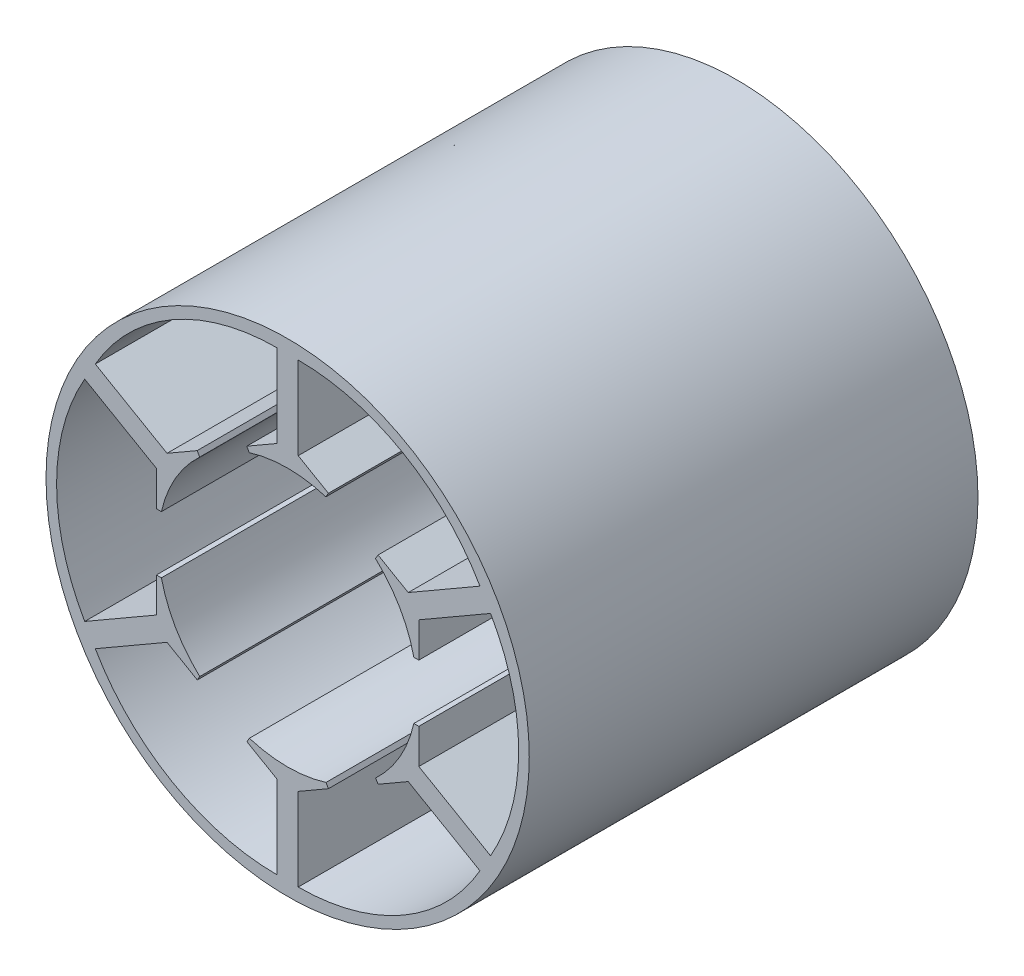
from build123d import *

# Parameters (mm, degrees)
MOTOR_BASE_R                    = 35
STATOR_SHELL_DEPTH              = 65
MOTOR_BASE_4_R                  = 18.75
CUT_EXTRUDE1_DEPTH              = 82.700673192
STATOR_LAMINATION_SUPPORT_DEPTH = 16.35
CUT_EXTRUDE3_DEPTH              = 82.700673192


with BuildPart() as part:
    # Motor_Base → Stator_Shell (new body)
    with BuildSketch(Plane.XY):
        Circle(MOTOR_BASE_R)
        with BuildLine():
            Line((1.533091596, 21.069409042), (1.533091596, 33.069409042))
            ThreePointArc((1.533091596, 33.069409042), (16.733091596, 28.996581317), (27.860263871, 17.869409042))
            Line((27.860263871, 17.869409042), (17.467959025, 11.869409042))
            Line((17.467959025, 11.869409042), (1.533091596, 21.069409042))
        make_face(mode=Mode.SUBTRACT)
        with BuildLine():
            Line((-1.533091596, 21.069409042), (-1.533091596, 33.069409042))
            ThreePointArc((-1.533091596, 33.069409042), (-16.733091596, 28.996581317), (-27.860263871, 17.869409042))
            Line((-27.860263871, 17.869409042), (-17.467959025, 11.869409042))
            Line((-17.467959025, 11.869409042), (-1.533091596, 21.069409042))
        make_face(mode=Mode.SUBTRACT)
        with BuildLine():
            Line((19.001050621, 9.214016506), (29.393355467, 15.214016506))
            ThreePointArc((29.393355467, 15.214016506), (33.466183191, 0.014016506), (29.393355467, -15.185983494))
            Line((29.393355467, -15.185983494), (19.001050621, -9.185983494))
            Line((19.001050621, -9.185983494), (19.001050621, 9.214016506))
        make_face(mode=Mode.SUBTRACT)
        with BuildLine():
            Line((17.467959025, -11.841376031), (27.860263871, -17.841376031))
            ThreePointArc((27.860263871, -17.841376031), (16.733091596, -28.968548306), (1.533091596, -33.041376031))
            Line((1.533091596, -33.041376031), (1.533091596, -21.041376031))
            Line((1.533091596, -21.041376031), (17.467959025, -11.841376031))
        make_face(mode=Mode.SUBTRACT)
        with BuildLine():
            Line((-1.533091596, -21.041376031), (-1.533091596, -33.041376031))
            ThreePointArc((-1.533091596, -33.041376031), (-16.733091596, -28.968548306), (-27.860263871, -17.841376031))
            Line((-27.860263871, -17.841376031), (-17.467959025, -11.841376031))
            Line((-17.467959025, -11.841376031), (-1.533091596, -21.041376031))
        make_face(mode=Mode.SUBTRACT)
        with BuildLine():
            Line((-19.001050621, -9.185983494), (-29.393355467, -15.185983494))
            ThreePointArc((-29.393355467, -15.185983494), (-33.466183191, 0.014016506), (-29.393355467, 15.214016506))
            Line((-29.393355467, 15.214016506), (-19.001050621, 9.214016506))
            Line((-19.001050621, 9.214016506), (-19.001050621, -9.185983494))
        make_face(mode=Mode.SUBTRACT)
    extrude(amount=STATOR_SHELL_DEPTH)

    # Motor_Base<4> → Cut-Extrude1 (cut, through all)
    with BuildSketch(Plane.XY):
        Circle(MOTOR_BASE_4_R)
    extrude(amount=CUT_EXTRUDE1_DEPTH, mode=Mode.SUBTRACT)

    # Stator_Lam_Support → Stator Lamination Support (add)
    with BuildSketch(Plane(origin=(0, 0, 0), x_dir=(-1, 0, 0), z_dir=(0, 0, -1))):
        with BuildLine():
            Line((14.351295245, 31.306334292), (13.506552589, 28.096442893))
            Line((13.506552589, 28.096442893), (17.559972866, 25.758191299))
            Line((17.559972866, 25.758191299), (19.915725917, 28.096442893))
            ThreePointArc((19.915725917, 28.096442893), (17.208516366, 29.831413083), (14.351295245, 31.306334292))
        make_face()
        with BuildLine():
            Line((34.287728419, 3.224580887), (31.085509595, 2.351203787))
            Line((31.085509595, 2.351203787), (31.087234454, -2.328286942))
            Line((31.087234454, -2.328286942), (34.29009626, -3.199303133))
            ThreePointArc((34.29009626, -3.199303133), (34.439019743, 0.012694207), (34.287728419, 3.224580887))
        make_face()
        with BuildLine():
            Line((19.936433174, -28.081753405), (17.578957007, -25.745239106))
            Line((17.578957007, -25.745239106), (13.527261587, -28.086478241))
            Line((13.527261587, -28.086478241), (14.374370343, -31.295746025))
            ThreePointArc((14.374370343, -31.295746025), (17.230503377, -29.818718876), (19.936433174, -28.081753405))
        make_face()
        with BuildLine():
            Line((-14.351295245, -31.306334292), (-13.506552589, -28.096442893))
            Line((-13.506552589, -28.096442893), (-17.559972866, -25.758191299))
            Line((-17.559972866, -25.758191299), (-19.915725917, -28.096442893))
            ThreePointArc((-19.915725917, -28.096442893), (-17.208516366, -29.831413083), (-14.351295245, -31.306334292))
        make_face()
        with BuildLine():
            Line((-34.287728419, -3.224580887), (-31.085509595, -2.351203787))
            Line((-31.085509595, -2.351203787), (-31.087234454, 2.328286942))
            Line((-31.087234454, 2.328286942), (-34.29009626, 3.199303133))
            ThreePointArc((-34.29009626, 3.199303133), (-34.439019743, -0.012694207), (-34.287728419, -3.224580887))
        make_face()
        with BuildLine():
            Line((-19.936433174, 28.081753405), (-17.578957007, 25.745239106))
            Line((-17.578957007, 25.745239106), (-13.527261587, 28.086478241))
            Line((-13.527261587, 28.086478241), (-14.374370343, 31.295746025))
            ThreePointArc((-14.374370343, 31.295746025), (-17.230503377, 29.818718876), (-19.936433174, 28.081753405))
        make_face()
    extrude(amount=-STATOR_LAMINATION_SUPPORT_DEPTH)

    # Sketch6 → Cut-Extrude3 (cut, through all)
    with BuildSketch(Plane.XY.offset(65)):
        Polygon((14.405256844, 16.666586459), (11.56399771, 11.741189457), (4.374457659, 15.888539677), (7.215716793, 20.813936679), align=None)
        Polygon((21.633256314, 4.15797429), (21.63631569, -4.142025146), (15.950167195, -4.144121058), (15.947107819, 4.155878379), align=None)
        Polygon((14.417539521, -16.655962389), (7.231058845, -20.808611605), (4.386169485, -15.885310514), (11.57265016, -11.732661299), align=None)
        Polygon((-7.215716793, -20.813936679), (-14.405256844, -16.666586459), (-11.56399771, -11.741189457), (-4.374457659, -15.888539677), align=None)
        Polygon((-21.633256314, -4.15797429), (-21.63631569, 4.142025146), (-15.950167195, 4.144121058), (-15.947107819, -4.155878379), align=None)
        Polygon((-14.417539521, 16.655962389), (-7.231058845, 20.808611605), (-4.386169485, 15.885310514), (-11.57265016, 11.732661299), align=None)
    extrude(amount=-CUT_EXTRUDE3_DEPTH, mode=Mode.SUBTRACT)


solid = part.part
